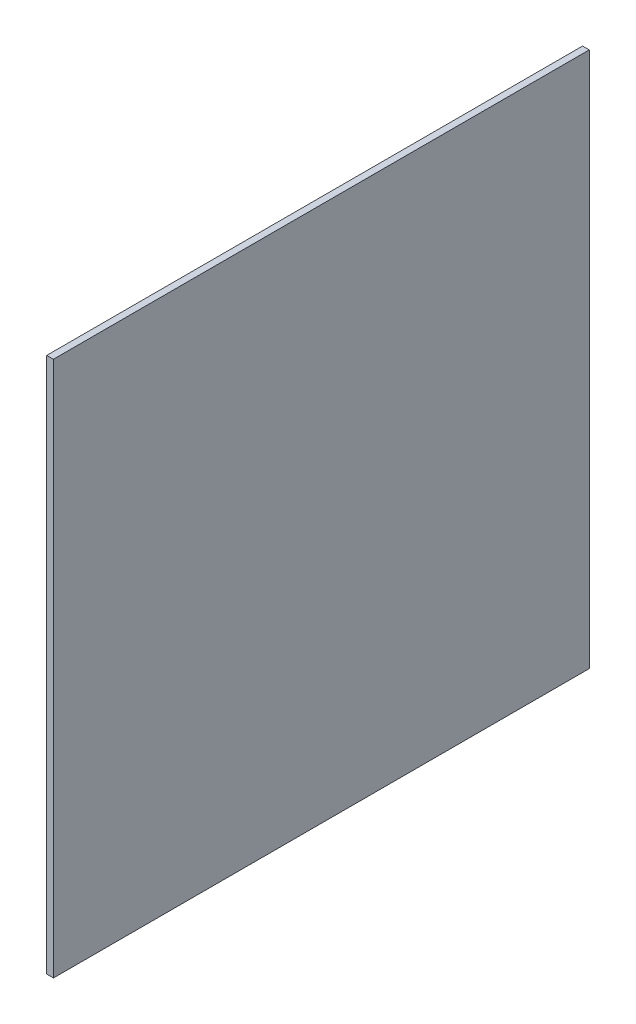
from build123d import *

# Parameters (mm, degrees)
SKETCH1_W           = 254
SKETCH1_H           = 254
BOSS_EXTRUDE1_DEPTH = 3.175


with BuildPart() as part:
    # Sketch1 → Boss-Extrude1 (new body)
    with BuildSketch(Plane(origin=(0, 0, 0), x_dir=(0, 0, -1), z_dir=(1, 0, 0))):
        Rectangle(SKETCH1_W, SKETCH1_H)
    extrude(amount=BOSS_EXTRUDE1_DEPTH)


solid = part.part
